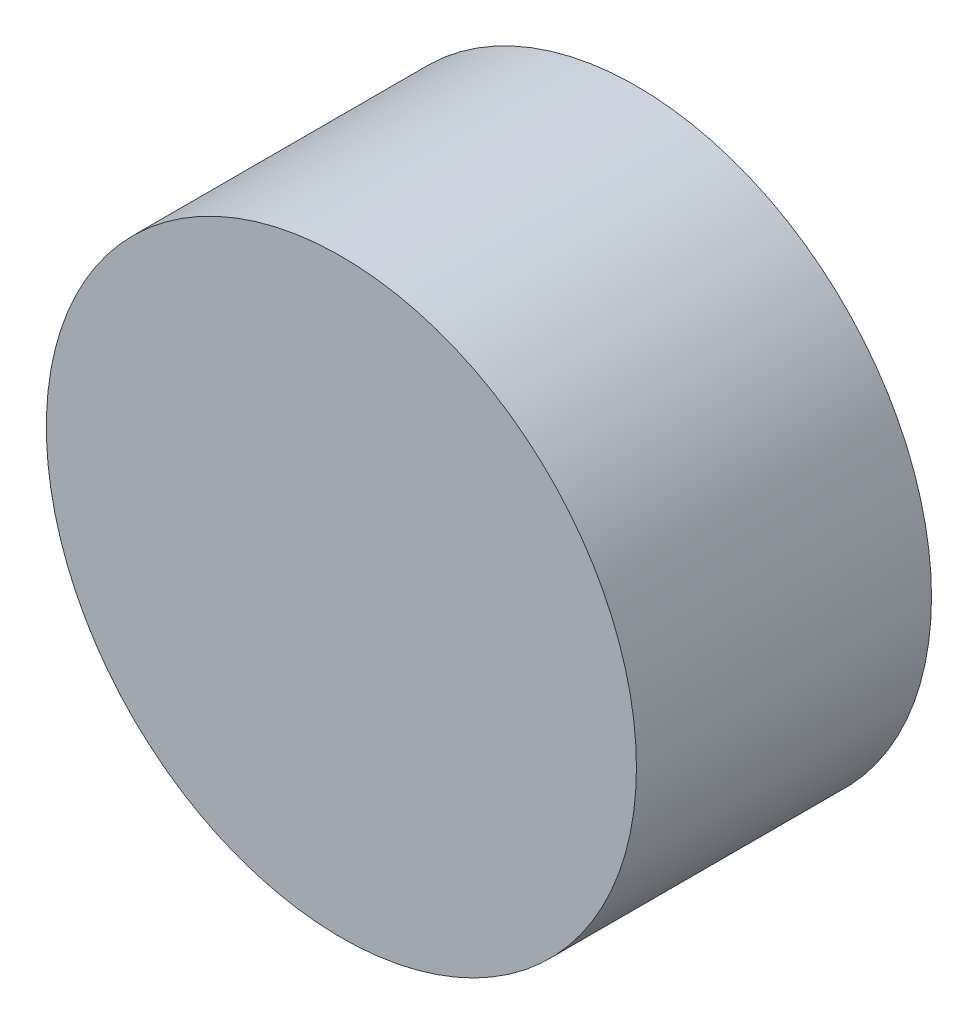
from build123d import *

# Parameters (mm, degrees)
SKETCH_1_R        = 4
PITCH_PIVOT_DEPTH = 4


with BuildPart() as part:
    # 草图1 → Pitch_Pivot (new body)
    with BuildSketch(Plane.XY):
        Circle(SKETCH_1_R)
    extrude(amount=PITCH_PIVOT_DEPTH)


solid = part.part
